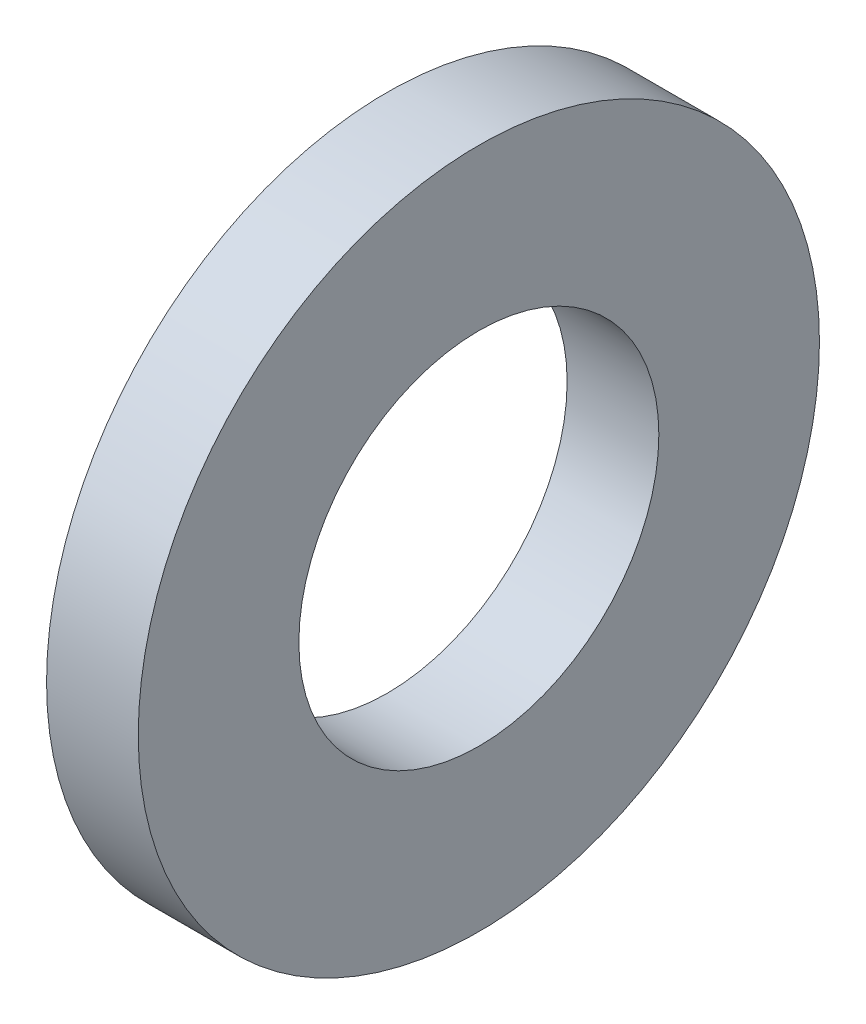
from build123d import *

# Parameters (mm, degrees)
SKETCH1_W = 1.75
SKETCH1_H = 3.065


with BuildPart() as part:
    # Sketch1 → Base-Revolve (revolve)
    with BuildSketch(Plane.XY, mode=Mode.PRIVATE) as base_revolve_sk:
        with Locations((-0.875, 4.9675)):
            Rectangle(SKETCH1_W, SKETCH1_H)
    revolve(base_revolve_sk.sketch.rotate(Axis((-34.925, 0, 0), (1, 0, 0)), 90), axis=Axis((-34.925, 0, 0), (1, 0, 0)))


solid = part.part
